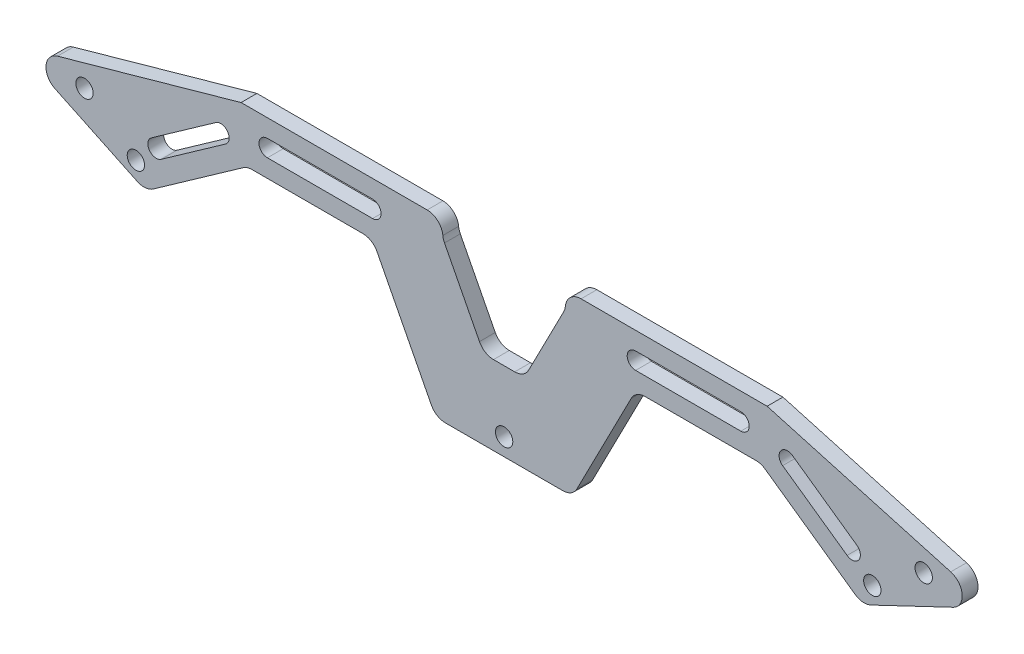
from build123d import *

# Parameters (mm, degrees)
SKETCH_1_R          = 1.65
EXTRUDE_1_DEPTH     = 3
CUT_EXTRUDE_1_DEPTH = 3
EXTRUDE_2_DEPTH     = 3
CUT_EXTRUDE_2_DEPTH = 3
FILLET_1_R          = 3
FILLET_2_R          = 3
SKETCH_7_R          = 1.65
CUT_EXTRUDE_4_DEPTH = 10
CUT_EXTRUDE_3_DEPTH = 3


with BuildPart() as part:
    # 草图1 → 凸台-拉伸1 (new body)
    with BuildSketch(Plane.XY):
        Polygon((-92.59237164, -12.480070197), (-72.241164341, -27), (-48.851597939, -10.5), (0, -10.5), (0, -0.5), (-50, -0.5), align=None)
        with Locations((-79.768579503, -13.030433694)):
            Circle(SKETCH_1_R, mode=Mode.SUBTRACT)
        with Locations((-70, -20)):
            Circle(SKETCH_1_R, mode=Mode.SUBTRACT)
    extrude(amount=EXTRUDE_1_DEPTH)

    # 镜向1: part across plane


with BuildPart() as part_1:
    add(part.part)
    add(part.part.mirror(Plane(origin=(0, -0.5, 3), x_dir=(0, 0, 1), z_dir=(-1, 0, 0))))

    # 草图2 → 切除-拉伸1 (cut)
    with BuildSketch(Plane.XY.offset(3)):
        Polygon((-92.59237164, -12.480070197), (-68.155479007, -24.11778291), (-72.241164341, -27), align=None)
        Polygon((92.59237164, -12.480070197), (68.155479007, -24.11778291), (72.241164341, -27), align=None)
    extrude(amount=-CUT_EXTRUDE_1_DEPTH, mode=Mode.SUBTRACT)

    # 草图3 → 凸台-拉伸2 (add)
    with BuildSketch(Plane.XY.offset(3)):
        Polygon((-25, -10.5), (-13, -33.83), (13, -33.83), (25, -10.5), align=None)
    extrude(amount=-EXTRUDE_2_DEPTH)

    # 草图4 → 切除-拉伸2 (cut)
    with BuildSketch(Plane.XY.offset(3)):
        Polygon((-11.661081625, -3.639004694), (-11.661081625, -0.5), (11.661081625, -0.5), (11.661081625, -3.639004694), (3.847453521, -18.83), (-3.847453521, -18.83), align=None)
    extrude(amount=-CUT_EXTRUDE_2_DEPTH, mode=Mode.SUBTRACT)

    # 圆角1
    fillet_1_edges = [part_1.edges().sort_by_distance(p)[0] for p in [
        (-48.851597939, -10.5, 1.5),
        (-92.59237164, -12.480070197, 1.5),
        (92.59237164, -12.480070197, 1.5),
        (48.851597939, -10.5, 1.5),
        (-68.155479007, -24.11778291, 1.5),
        (68.155479007, -24.11778291, 1.5),
        (-13, -33.83, 1.5),
        (13, -33.83, 1.5),
        (25, -10.5, 1.5),
        (-25, -10.5, 1.5),
        (11.661081625, -3.639004694, 1.5),
        (3.847453521, -18.83, 1.5),
        (-3.847453521, -18.83, 1.5),
        (-11.661081625, -3.639004694, 1.5),
    ]]
    fillet(fillet_1_edges, radius=FILLET_1_R)

    # 圆角2
    fillet_2_edges = [part_1.edges().sort_by_distance(p)[0] for p in [
        (11.661081625, -0.5, 1.5),
        (-11.661081625, -0.5, 1.5),
    ]]
    fillet(fillet_2_edges, radius=FILLET_2_R)

    # 草图7 → 切除-拉伸4 (cut)
    with BuildSketch(Plane.XY.offset(3)):
        with Locations((0, -30.53)):
            Circle(SKETCH_7_R)
    extrude(amount=-CUT_EXTRUDE_4_DEPTH, mode=Mode.SUBTRACT)

    # 草图5 → 切除-拉伸3 (cut)
    with BuildSketch(Plane.XY.offset(3)):
        with BuildLine():
            Line((-45, -3.9), (-25, -3.9))
            ThreePointArc((-25, -3.9), (-23.4, -5.5), (-25, -7.1))
            Line((-25, -7.1), (-45, -7.1))
            ThreePointArc((-45, -7.1), (-46.6, -5.5), (-45, -3.9))
        make_face()
        with BuildLine():
            Line((-67.050837469, -14.839231963), (-54.793781468, -6.192580693))
            ThreePointArc((-54.793781468, -6.192580693), (-52.564052692, -6.577690531), (-52.949162531, -8.807419307))
            Line((-52.949162531, -8.807419307), (-65.206218532, -17.454070576))
            ThreePointArc((-65.206218532, -17.454070576), (-67.435947308, -17.068960738), (-67.050837469, -14.839231963))
        make_face()
    cut_extrude_3 = extrude(amount=-CUT_EXTRUDE_3_DEPTH, mode=Mode.SUBTRACT)

    # 镜向2: 切除-拉伸3 across plane
    add(cut_extrude_3.mirror(Plane(origin=(0, 0, 0), x_dir=(0, 0, 1), z_dir=(1, 0, 0))), mode=Mode.SUBTRACT)


solid = part_1.part
